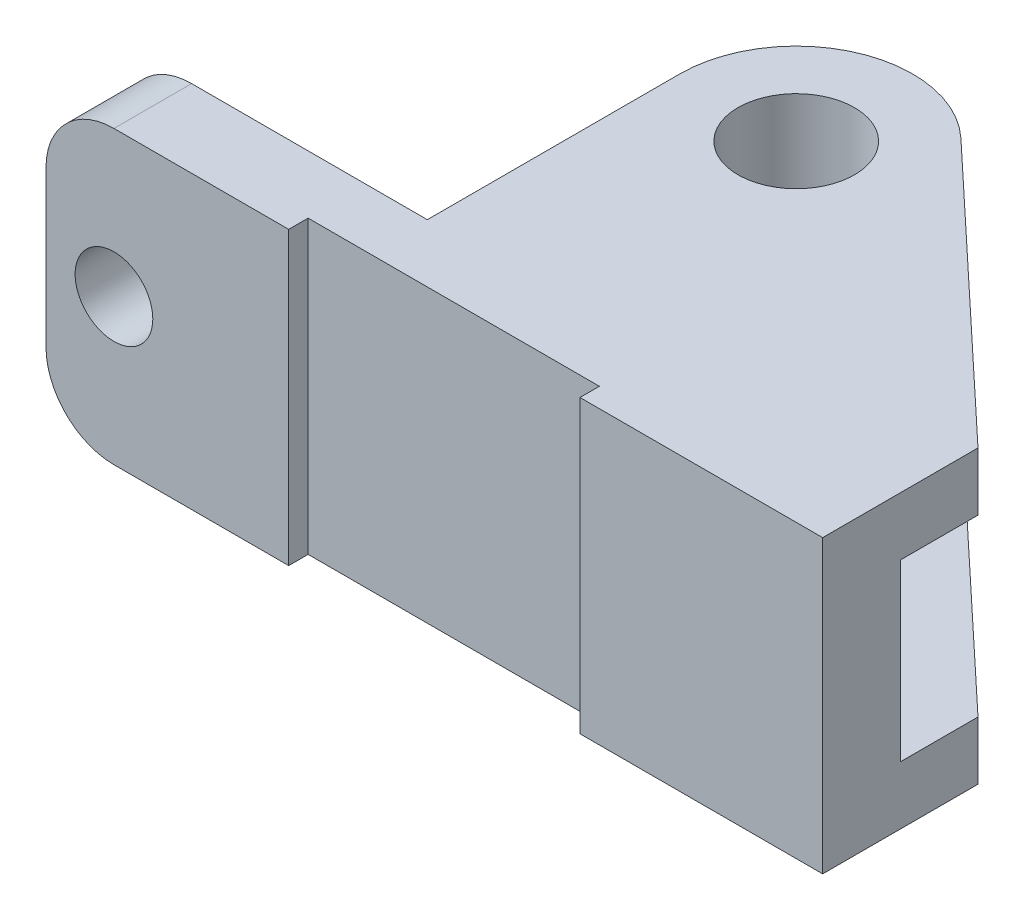
from build123d import *

# Parameters (mm, degrees)
BOSS_EXTRUDE1_DEPTH = 8
SKETCH2_R           = 4
CUT_EXTRUDE1_DEPTH  = 44.462627624
BOSS_EXTRUDE2_DEPTH = 6
SKETCH5_R           = 12
BOSS_EXTRUDE3_DEPTH = 30
SKETCH8_R           = 6
CUT_EXTRUDE2_DEPTH  = 63.801273872
SKETCH9_W           = 30
SKETCH9_H           = 2
CUT_EXTRUDE3_DEPTH  = 63.801273872


with BuildPart() as part:
    # Sketch1 → Boss-Extrude1 (new body)
    with BuildSketch(Plane.XY):
        with BuildLine():
            Line((-33, -15), (40, -15))
            Line((40, -15), (40, 15))
            Line((40, 15), (-33, 15))
            ThreePointArc((-33, 15), (-37.949747468, 12.949747468), (-40, 8))
            Line((-40, 8), (-40, -8))
            ThreePointArc((-40, -8), (-37.949747468, -12.949747468), (-33, -15))
        make_face()
    extrude(amount=BOSS_EXTRUDE1_DEPTH)

    # Sketch2 → Cut-Extrude1 (cut, through all)
    with BuildSketch(Plane.XY.offset(8)):
        with Locations((-33, 0)):
            Circle(SKETCH2_R)
    extrude(amount=-CUT_EXTRUDE1_DEPTH, mode=Mode.SUBTRACT)

    # Sketch3 → Boss-Extrude2 (add)
    with BuildSketch(Plane(origin=(0, 15, 0), x_dir=(1, 0, 0), z_dir=(0, 1, 0))):
        Polygon((-8.722846682, 0), (40, 0), (40, 8), (20.815154113, 26), (-8.722846682, 26), align=None)
        Polygon((-8.722846682, 26), (20.815154113, 26), (11.487895334, 34.751212233), align=None)
    boss_extrude2 = extrude(amount=-BOSS_EXTRUDE2_DEPTH)

    # Mirror1: Boss-Extrude2 across plane
    add(boss_extrude2.mirror(Plane.ZX))

    # Sketch5 → Boss-Extrude3 (add, through all)
    with BuildSketch(Plane(origin=(0, 15, 0), x_dir=(1, 0, 0), z_dir=(0, 1, 0))):
        with Locations(Location((3.277153318, 26, 0), (0, 0, 180))):
            Circle(SKETCH5_R)
    extrude(amount=-BOSS_EXTRUDE3_DEPTH)

    # Sketch8 → Cut-Extrude2 (cut, through all)
    with BuildSketch(Plane(origin=(0, 15, 0), x_dir=(1, 0, 0), z_dir=(0, 1, 0))):
        with Locations(Location((3.277153318, 26, 0), (0, 0, 180))):
            Circle(SKETCH8_R)
    extrude(amount=-CUT_EXTRUDE2_DEPTH, mode=Mode.SUBTRACT)

    # Sketch9 → Cut-Extrude3 (cut, through all)
    with BuildSketch(Plane(origin=(0, 15, 0), x_dir=(1, 0, 0), z_dir=(0, 1, 0))):
        with Locations((0, -7)):
            Rectangle(SKETCH9_W, SKETCH9_H)
    extrude(amount=-CUT_EXTRUDE3_DEPTH, mode=Mode.SUBTRACT)


solid = part.part
